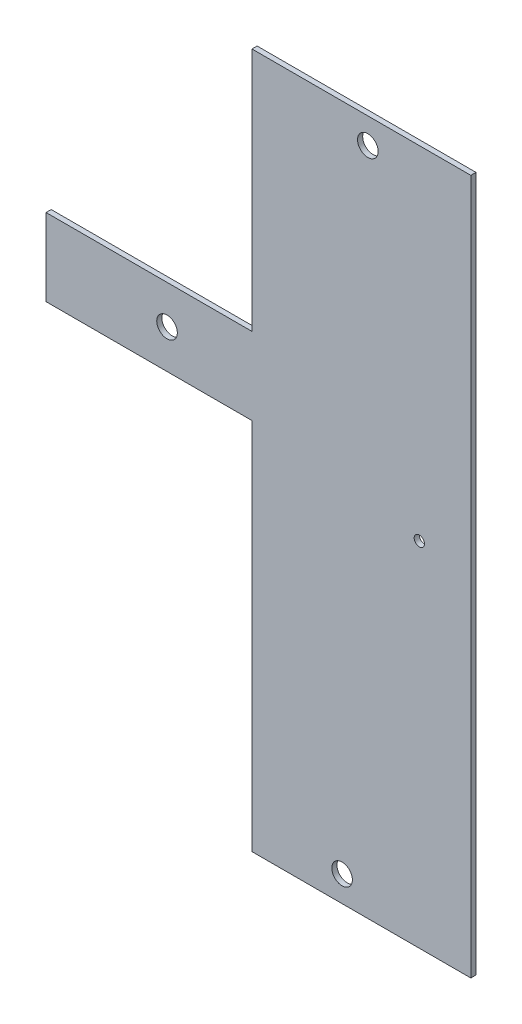
from build123d import *

# Parameters (mm, degrees)
EXTRUDE2_DEPTH     = 2
SKETCH3_R          = 4
SKETCH3_R_2        = 2
CUT_EXTRUDE1_DEPTH = 2


with BuildPart() as part:
    # Sketch2 → Extrude2 (new body)
    with BuildSketch(Plane.XY):
        Polygon((-70.048802494, 14.603160243), (9.951197506, 14.603160243), (9.951197506, 109.603160243), (94.951197506, 109.603160243), (94.951197506, -160.396839757), (9.951197506, -160.396839757), (9.951197506, -15.396839757), (-70.048802494, -15.396839757), align=None)
    extrude(amount=EXTRUDE2_DEPTH)

    # Sketch3 → Cut-Extrude1 (cut)
    with BuildSketch(Plane(origin=(0, 0, 0), x_dir=(-1, 0, 0), z_dir=(0, 0, -1))):
        with Locations((-54.951197506, 99.603160243)):
            Circle(SKETCH3_R)
        with Locations((23.048802494, -0.396839757)):
            Circle(SKETCH3_R)
        with Locations((-74.951297506, -23.396839757)):
            Circle(SKETCH3_R_2)
        with Locations((-44.951197506, -150.396839757)):
            Circle(SKETCH3_R)
    extrude(amount=-CUT_EXTRUDE1_DEPTH, mode=Mode.SUBTRACT)


solid = part.part
